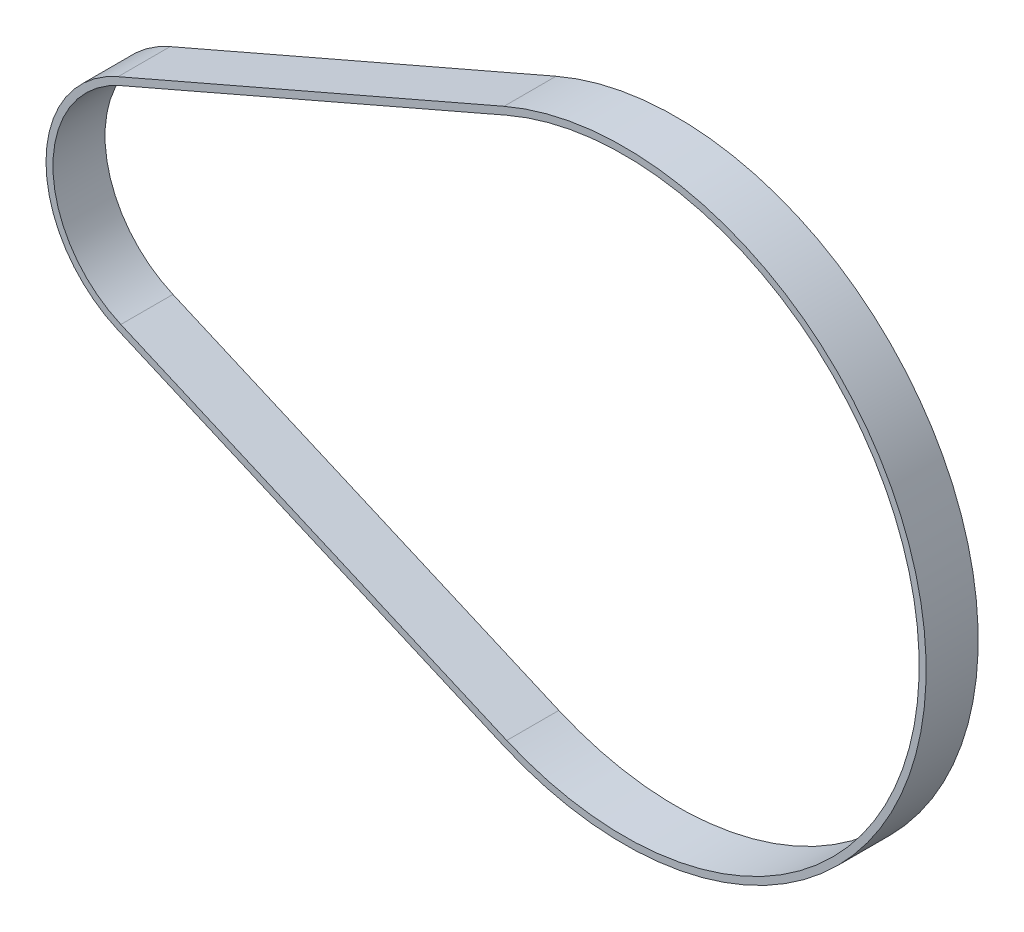
from build123d import *

# Parameters (mm, degrees)
EXTRUDE_1_DEPTH      = 3
EXTRUDE_1_DEPTH_BACK = 3


with BuildPart() as part:
    # 草图1 → 凸台-拉伸1 (new, two sides: drawn at the far end of the back side and taken through both)
    with BuildSketch(Plane.XY.offset(-EXTRUDE_1_DEPTH_BACK)):
        with BuildLine():
            Line((-5.483999587, -12.650498258), (38.980167841, -31.925745039))
            ThreePointArc((38.980167841, -31.925745039), (87.6164675, 0), (38.980167841, 31.925745039))
            Line((38.980167841, 31.925745039), (-5.483999587, 12.650498258))
            ThreePointArc((-5.483999587, 12.650498258), (-13.788015, 0), (-5.483999587, -12.650498258))
        make_face()
        with BuildLine():
            Line((-5.165810227, -11.916498577), (39.298357201, -31.191745358))
            ThreePointArc((39.298357201, -31.191745358), (86.8164675, 0), (39.298357201, 31.191745358))
            Line((39.298357201, 31.191745358), (-5.165810227, 11.916498577))
            ThreePointArc((-5.165810227, 11.916498577), (-12.988015, 0), (-5.165810227, -11.916498577))
        make_face(mode=Mode.SUBTRACT)
    extrude(amount=EXTRUDE_1_DEPTH + EXTRUDE_1_DEPTH_BACK)


solid = part.part
